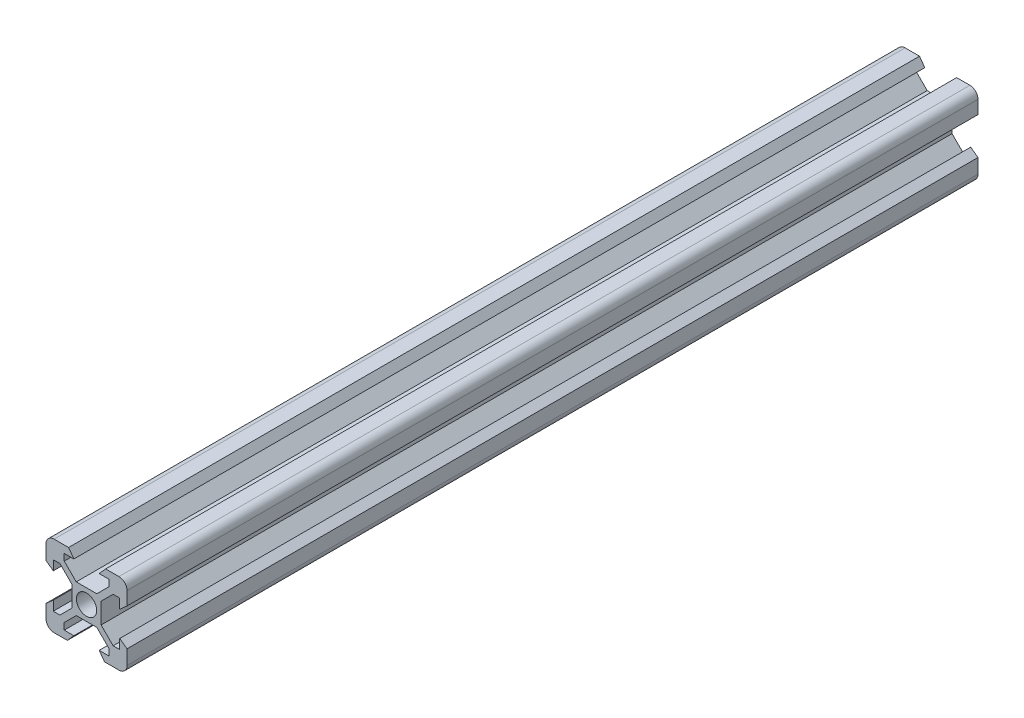
from build123d import *

# Parameters (mm, degrees)
SKETCH1_R           = 2.5
BOSS_EXTRUDE1_DEPTH = 210


with BuildPart() as part:
    # Sketch1 → Boss-Extrude1 (new body)
    with BuildSketch(Plane.XY):
        with BuildLine():
            Line((-4.725542729, -10), (-3.125, -8.2))
            Line((-3.125, -8.2), (-5.5, -8.2))
            Line((-5.5, -8.2), (-5.5, -6.560660172))
            Line((-5.5, -6.560660172), (-2.539339828, -3.6))
            Line((-2.539339828, -3.6), (2.539339828, -3.6))
            Line((2.539339828, -3.6), (5.5, -6.560660172))
            Line((5.5, -6.560660172), (5.5, -8.2))
            Line((5.5, -8.2), (3.125, -8.2))
            Line((3.125, -8.2), (4.434457271, -10))
            Line((4.434457271, -10), (8, -10))
            ThreePointArc((8, -10), (9.414213562, -9.414213562), (10, -8))
            Line((10, -8), (10, -4.434457271))
            Line((10, -4.434457271), (8.2, -3.125))
            Line((8.2, -3.125), (8.2, -5.5))
            Line((8.2, -5.5), (6.560660172, -5.5))
            Line((6.560660172, -5.5), (3.6, -2.539339828))
            Line((3.6, -2.539339828), (3.6, 2.539339828))
            Line((3.6, 2.539339828), (6.560660172, 5.5))
            Line((6.560660172, 5.5), (8.2, 5.5))
            Line((8.2, 5.5), (8.2, 3.125))
            Line((8.2, 3.125), (10, 4.725542729))
            Line((10, 4.725542729), (10, 8))
            ThreePointArc((10, 8), (9.414213562, 9.414213562), (8, 10))
            Line((8, 10), (4.725542729, 10))
            Line((4.725542729, 10), (3.125, 8.2))
            Line((3.125, 8.2), (5.5, 8.2))
            Line((5.5, 8.2), (5.5, 6.560660172))
            Line((5.5, 6.560660172), (2.539339828, 3.6))
            Line((2.539339828, 3.6), (-2.539339828, 3.6))
            Line((-2.539339828, 3.6), (-5.5, 6.560660172))
            Line((-5.5, 6.560660172), (-5.5, 8.2))
            Line((-5.5, 8.2), (-3.125, 8.2))
            Line((-3.125, 8.2), (-4.434457271, 10))
            Line((-4.434457271, 10), (-8, 10))
            ThreePointArc((-8, 10), (-9.414213562, 9.414213562), (-10, 8))
            Line((-10, 8), (-10, 4.434457271))
            Line((-10, 4.434457271), (-8.2, 3.125))
            Line((-8.2, 3.125), (-8.2, 5.5))
            Line((-8.2, 5.5), (-6.560660172, 5.5))
            Line((-6.560660172, 5.5), (-3.6, 2.539339828))
            Line((-3.6, 2.539339828), (-3.6, -2.539339828))
            Line((-3.6, -2.539339828), (-6.560660172, -5.5))
            Line((-6.560660172, -5.5), (-8.2, -5.5))
            Line((-8.2, -5.5), (-8.2, -3.125))
            Line((-8.2, -3.125), (-10, -4.725542729))
            Line((-10, -4.725542729), (-10, -8))
            ThreePointArc((-10, -8), (-9.414213562, -9.414213562), (-8, -10))
            Line((-8, -10), (-4.725542729, -10))
        make_face()
        Circle(SKETCH1_R, mode=Mode.SUBTRACT)
    extrude(amount=BOSS_EXTRUDE1_DEPTH)


solid = part.part
